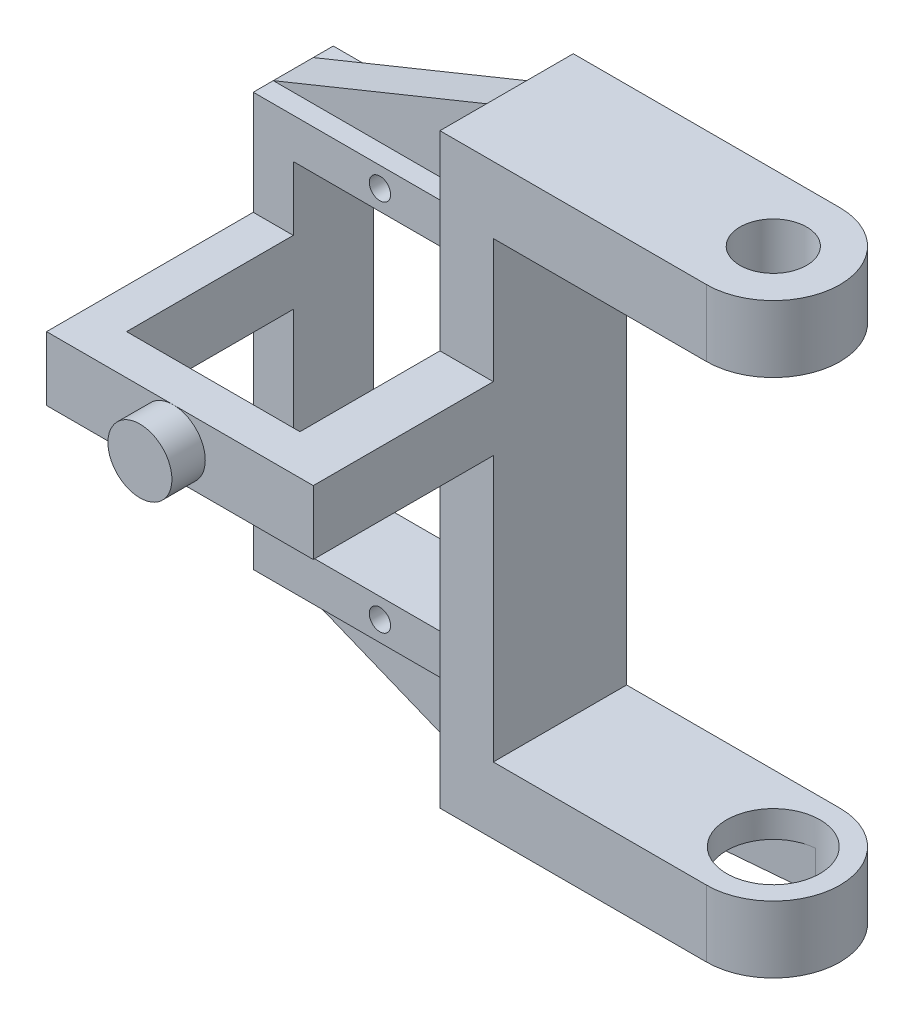
from build123d import *

# Parameters (mm, degrees)
SKETCH2_W               = 25
SKETCH2_H               = 10
BOSS_EXTRUDE1_DEPTH     = 5
FILLET1_RADIUS          = 5
FILLET1_LENGTH          = 5
SKETCH3_W               = 4
SKETCH3_H               = 10
BOSS_EXTRUDE2_DEPTH     = 17
SKETCH12_R              = 2.5
CUT_EXTRUDE3_DEPTH      = 5
CUT_EXTRUDE4_DEPTH      = 3
SKETCH14_R              = 3.5
CUT_EXTRUDE5_DEPTH      = 2
SKETCH15_W              = 10
SKETCH15_H              = 15.5
BOSS_EXTRUDE3_DEPTH     = 16
SKETCH16_W              = 16
SKETCH16_H              = 2
CUT_EXTRUDE6_DEPTH      = 31
CUT_EXTRUDE9_DEPTH      = 54.030651514
CUT_EXTRUDE9_DEPTH_BACK = 6
SKETCH18_W              = 13
SKETCH18_H              = 25
RIB1_REACH              = 54.662
SKETCH20_WALL_W         = 124.593227798
SKETCH20_WALL_H         = 3
RIB2_REACH              = 54.662
SKETCH21_WALL_W         = 124.593227798
SKETCH21_WALL_H         = 3
SKETCH22_R              = 0.8
CUT_EXTRUDE10_DEPTH     = 6
BOSS_EXTRUDE4_DEPTH     = 15.5
SKETCH39_W              = 3
SKETCH39_H              = 4.8
BOSS_EXTRUDE5_DEPTH     = 17
SKETCH42_W              = 4
SKETCH42_H              = 4.8
BOSS_EXTRUDE6_DEPTH     = 10.5
SKETCH43_R              = 2.4
BOSS_EXTRUDE7_DEPTH     = 2.5


with BuildPart() as part:
    # Sketch2 → Boss-Extrude1 (new body)
    with BuildSketch(Plane(origin=(0, 0, 0), x_dir=(1, 0, 0), z_dir=(0, 1, 0))):
        Rectangle(SKETCH2_W, SKETCH2_H)
    extrude(amount=BOSS_EXTRUDE1_DEPTH)

    # Fillet1: full round fillet: the end face becomes a half cylinder, R = half its width
    fillet1_face = Plane((12.5, 2.5, 0), x_dir=(0, -1, 0), z_dir=(1, 0, 0))  # on the end face: x along it, z out of the body
    fillet1_slab = fillet1_face.offset(-FILLET1_RADIUS / 2) * Box(FILLET1_LENGTH, 2 * FILLET1_RADIUS, FILLET1_RADIUS, mode=Mode.PRIVATE)  # the body's end, R deep
    fillet1_round = Plane((7.5, 2.5, 0), x_dir=(1, 0, 0), z_dir=(0, -1, 0)) * Cylinder(FILLET1_RADIUS, FILLET1_LENGTH, mode=Mode.PRIVATE)  # its axis R under the face
    add(fillet1_slab - fillet1_round, mode=Mode.SUBTRACT)

    # Sketch3 → Boss-Extrude2 (add)
    with BuildSketch(Plane(origin=(0, 5, 0), x_dir=(1, 0, 0), z_dir=(0, 1, 0))):
        with Locations((-10.5, 0)):
            Rectangle(SKETCH3_W, SKETCH3_H)
    extrude(amount=BOSS_EXTRUDE2_DEPTH)

    # Mirror1: part across plane


with BuildPart() as part_1:
    add(part.part)
    add(part.part.mirror(Plane.ZX.offset(22)))

    # Sketch12 → Cut-Extrude3 (cut)
    with BuildSketch(Plane(origin=(0, 44, 0), x_dir=(1, 0, 0), z_dir=(0, 1, 0))):
        with Locations(Location((7.5, 0, 0), (0, 0, 270))):
            Circle(SKETCH12_R)
    extrude(amount=-CUT_EXTRUDE3_DEPTH, mode=Mode.SUBTRACT)

    # Sketch13 → Cut-Extrude4 (cut)
    with BuildSketch(Plane.XZ):
        with BuildLine():
            Line((7.195652174, 3.486742377), (-8.782608696, 2.092045426))
            ThreePointArc((-8.782608696, 2.092045426), (-10.7, 0), (-8.782608696, -2.092045426))
            Line((-8.782608696, -2.092045426), (7.195652174, -3.486742377))
            ThreePointArc((7.195652174, -3.486742377), (11, 0), (7.195652174, 3.486742377))
        make_face()
    extrude(amount=-CUT_EXTRUDE4_DEPTH, mode=Mode.SUBTRACT)

    # Sketch14 → Cut-Extrude5 (cut)
    with BuildSketch(Plane.XZ.offset(-3)):
        with Locations(Location((7.5, 0, 0), (0, 0, 270))):
            Circle(SKETCH14_R)
    extrude(amount=-CUT_EXTRUDE5_DEPTH, mode=Mode.SUBTRACT)

    # Sketch15 → Boss-Extrude3 (add)
    with BuildSketch(Plane.ZY.offset(12.5)):
        with Locations((0, 14.25)):
            Rectangle(SKETCH15_W, SKETCH15_H)
        with Locations((0, 29.75)):
            Rectangle(SKETCH15_W, SKETCH15_H)
    extrude(amount=BOSS_EXTRUDE3_DEPTH)

    # Sketch16 → Cut-Extrude6 (cut)
    with BuildSketch(Plane.XZ.offset(-6.5)):
        with Locations((-20.5, 4)):
            Rectangle(SKETCH16_W, SKETCH16_H)
        with Locations((-20.5, -4)):
            Rectangle(SKETCH16_W, SKETCH16_H)
    extrude(amount=-CUT_EXTRUDE6_DEPTH, mode=Mode.SUBTRACT)

    # Sketch18 → Cut-Extrude9 (cut, two sides: drawn at the far end of the back side and taken through both)
    with BuildSketch(Plane(origin=(0, 0, -3), x_dir=(-1, 0, 0), z_dir=(0, 0, -1)).offset(-CUT_EXTRUDE9_DEPTH_BACK)):
        with Locations((19, 22)):
            Rectangle(SKETCH18_W, SKETCH18_H)
    extrude(amount=CUT_EXTRUDE9_DEPTH + CUT_EXTRUDE9_DEPTH_BACK, mode=Mode.SUBTRACT)

    # Sketch20 wall → Rib1 (add, up to next)
    with BuildSketch(Plane(origin=(-20.5, 40.75, 0), x_dir=(0.926466577122, 0.376377046956, 0), z_dir=(-0.376377046956, 0.926466577122, 0)), mode=Mode.PRIVATE) as rib1_sk1:
        Rectangle(SKETCH20_WALL_W, SKETCH20_WALL_H)
    rib1_tool1 = extrude(rib1_sk1.sketch, amount=-RIB1_REACH, mode=Mode.PRIVATE) - part_1.part
    add(rib1_tool1.solids().sort_by_distance((-20.5, 40.75, 0))[0])

    # Sketch21 wall → Rib2 (add, up to next)
    with BuildSketch(Plane(origin=(-20.5, 3.25, 0), x_dir=(0.926466577122, -0.376377046956, 0), z_dir=(0.376377046956, 0.926466577122, 0)), mode=Mode.PRIVATE) as rib2_sk1:
        Rectangle(SKETCH21_WALL_W, SKETCH21_WALL_H)
    rib2_tool1 = extrude(rib2_sk1.sketch, amount=RIB2_REACH, mode=Mode.PRIVATE) - part_1.part
    add(rib2_tool1.solids().sort_by_distance((-20.5, 3.25, 0))[0])

    # Sketch22 → Cut-Extrude10 (cut)
    with BuildSketch(Plane.XY.offset(3)):
        with Locations((-19, 36)):
            Circle(SKETCH22_R)
        with Locations(Location((-19, 8, 0), (0, 0, 180))):
            Circle(SKETCH22_R)
    extrude(amount=-CUT_EXTRUDE10_DEPTH, mode=Mode.SUBTRACT)

    # Sketch38 → Boss-Extrude4 (add)
    with BuildSketch(Plane.XY.offset(3)):
        Polygon((-25.5, 27.3), (-25.5, 24.9), (-28.5, 24.9), (-28.5, 29.7), (-25.5, 29.7), align=None)
    extrude(amount=BOSS_EXTRUDE4_DEPTH)

    # Sketch39 → Boss-Extrude5 (add)
    with BuildSketch(Plane(origin=(-25.5, 0, 0), x_dir=(0, 0, -1), z_dir=(1, 0, 0))):
        with Locations((-17, 27.3)):
            Rectangle(SKETCH39_W, SKETCH39_H)
    extrude(amount=BOSS_EXTRUDE5_DEPTH)

    # Sketch42 → Boss-Extrude6 (add)
    with BuildSketch(Plane(origin=(0, 0, 15.5), x_dir=(-1, 0, 0), z_dir=(0, 0, -1))):
        with Locations((10.5, 27.3)):
            Rectangle(SKETCH42_W, SKETCH42_H)
    extrude(amount=BOSS_EXTRUDE6_DEPTH)

    # Sketch43 → Boss-Extrude7 (add)
    with BuildSketch(Plane.XY.offset(18.5)):
        with Locations(Location((-19, 27.3, 0), (0, 0, 270))):
            Circle(SKETCH43_R)
    extrude(amount=BOSS_EXTRUDE7_DEPTH)


solid = part_1.part
